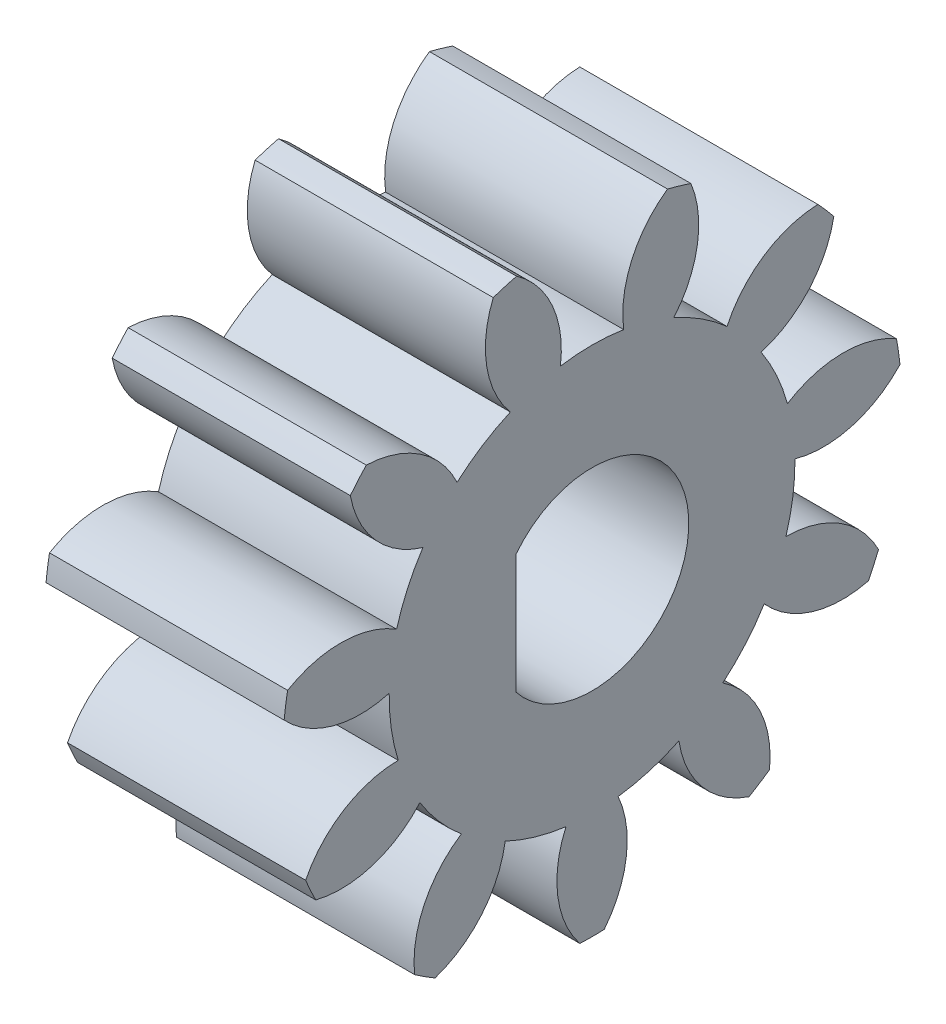
from build123d import *

# Parameters (mm, degrees)
BASPROSKE_W        = 6.35
BASPROSKE_H        = 8.255
TOOTHCUT_DEPTH     = 14.289565456
TEETHCUTS_COUNT    = 11
TEETHCUTS_ANGLE    = 327.272727273
BORSKE_R           = 1.5875
BORE_DEPTH         = 50.8000508
CUT_EXTRUDE1_REACH = 15.262
SKETCH3_R          = 1.5875


with BuildPart() as part:
    # BasProSke → Base-Revolve (revolve)
    with BuildSketch(Plane(origin=(0, 0, 0), x_dir=(1, 0, 0), z_dir=(0, 1, 0)), mode=Mode.PRIVATE) as base_revolve_sk:
        with Locations((3.175, 4.1275)):
            Rectangle(BASPROSKE_W, BASPROSKE_H)
    revolve(base_revolve_sk.sketch.rotate(Axis((-10, 0, 0), (1, 0, 0)), 180), axis=Axis((-10, 0, 0), (1, 0, 0)))

    # TooCutSke → ToothCut (cut, through all)
    with BuildSketch(Plane(origin=(0, 0, 0), x_dir=(0, 0, -1), z_dir=(1, 0, 0))):
        with BuildLine():
            ThreePointArc((0.844285256, 5.34391677), (0, 5.4102), (-0.844285256, 5.34391677))
            ThreePointArc((-0.844285256, 5.34391677), (-1.061642965, 6.854251062), (-2.040080862, 8.025153845))
            ThreePointArc((-2.040080862, 8.025153845), (0, 8.2804), (2.040080862, 8.025153845))
            ThreePointArc((2.040080862, 8.025153845), (1.061642965, 6.854251062), (0.844285256, 5.34391677))
        make_face()
    toothcut = extrude(amount=TOOTHCUT_DEPTH, mode=Mode.SUBTRACT)

    # TeethCuts: ToothCut ×11 about axis
    teethcuts_axis = Axis((-10, 0, 0), (1, 0, 0))
    for i in range(1, TEETHCUTS_COUNT):
        add(toothcut.rotate(teethcuts_axis, i * TEETHCUTS_ANGLE / (TEETHCUTS_COUNT - 1)), mode=Mode.SUBTRACT)

    # BorSke → Bore (cut, symmetric)
    with BuildSketch(Plane(origin=(0, 0, 0), x_dir=(0, 0, -1), z_dir=(1, 0, 0))):
        with Locations(Location((0, 0, 0), (0, 0, 180))):
            Circle(BORSKE_R)
    extrude(amount=BORE_DEPTH, both=True, mode=Mode.SUBTRACT)

    # Sketch3 → Cut-Extrude1 (cut, up to next)
    with BuildSketch(Plane.ZY, mode=Mode.PRIVATE) as cut_extrude1_sk1:
        with BuildLine():
            Line((2.033379293, -1.5875), (2.033379293, 1.5875))
            ThreePointArc((2.033379293, 1.5875), (-2.5796875, 0), (2.033379293, -1.5875))
        make_face()
        Circle(SKETCH3_R, mode=Mode.SUBTRACT)
    cut_extrude1_tool1 = extrude(cut_extrude1_sk1.sketch, amount=-CUT_EXTRUDE1_REACH, mode=Mode.PRIVATE) & part.part
    add(cut_extrude1_tool1.solids().sort_by_distance((0, 0, 1.96417))[0], mode=Mode.SUBTRACT)


solid = part.part
